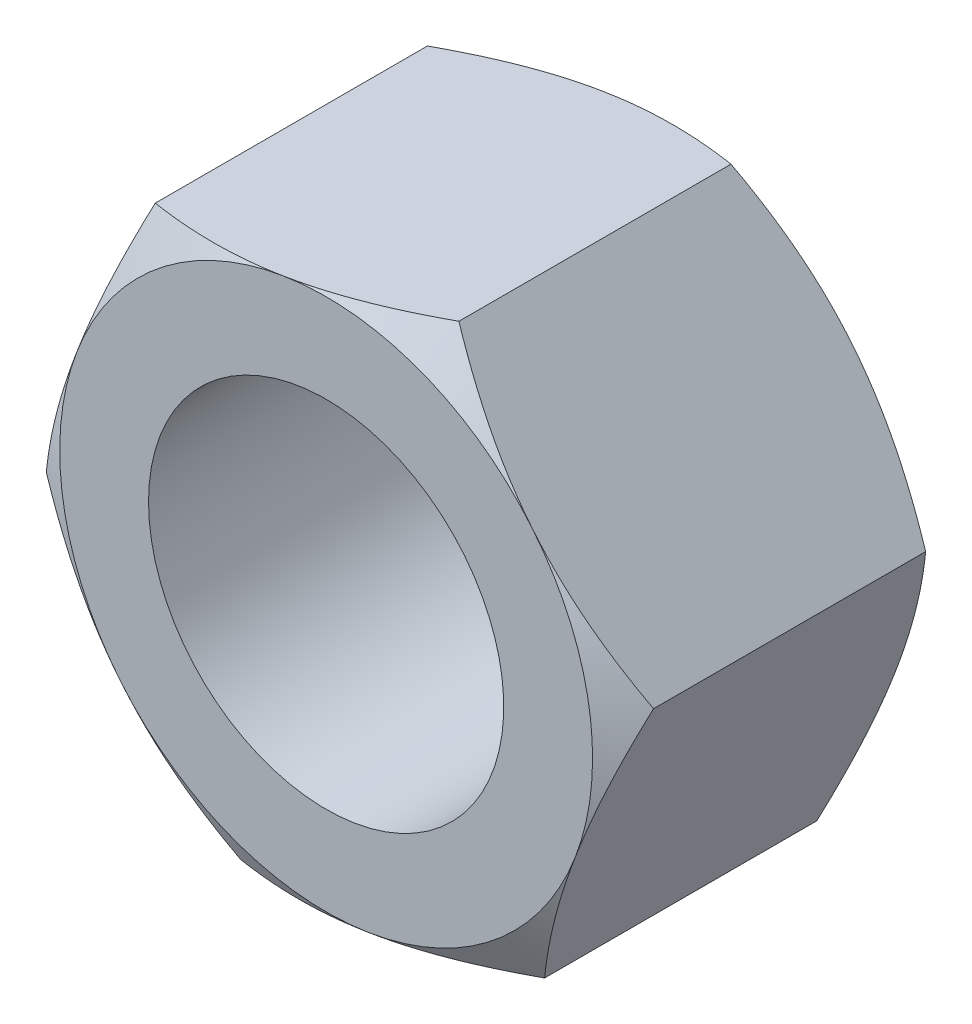
from build123d import *

# Parameters (mm, degrees)
BOSS_EXTRUDE1_DEPTH = 18
SKETCH2_OUTSIDE_W   = 108.628
SKETCH2_OUTSIDE_H   = 106.834
SKETCH2_OUTSIDE_R   = 15
CUT_EXTRUDE1_DEPTH  = 18
CUT_EXTRUDE1_DRAFT  = -60
SKETCH3_OUTSIDE_W   = 108.628
SKETCH3_OUTSIDE_H   = 106.834
SKETCH3_OUTSIDE_R   = 15
CUT_EXTRUDE2_DEPTH  = 18
CUT_EXTRUDE2_DRAFT  = -60
SKETCH4_R           = 10
CUT_EXTRUDE3_DEPTH  = 30.641307412


with BuildPart() as part:
    # Sketch1 → Boss-Extrude1 (new body)
    with BuildSketch(Plane.XY):
        Polygon((6.134122691, 16.197917731), (-10.960746898, 13.411264946), (-17.094869589, -2.786652785), (-6.134122691, -16.197917731), (10.960746898, -13.411264946), (17.094869589, 2.786652785), align=None)
    extrude(amount=BOSS_EXTRUDE1_DEPTH)


with BuildPart() as cut_extrude1_tool:
    # Sketch2 outside → Cut-Extrude1 (with draft: the straight prism first)
    with BuildSketch(Plane.XY.offset(18)):
        Rectangle(SKETCH2_OUTSIDE_W, SKETCH2_OUTSIDE_H)
        Circle(SKETCH2_OUTSIDE_R, mode=Mode.SUBTRACT)
    extrude(amount=-CUT_EXTRUDE1_DEPTH)
    # Cut-Extrude1: the draft: its side faces are tilted about the plane it starts from
    cut_extrude1_sides = [cut_extrude1_tool.faces().sort_by_distance(p)[0] for p in [
        (0, -53.417, 9),
        (54.314, 0, 9),
        (0, 53.417, 9),
        (-54.314, 0, 9),
        (-15, 0, 9),
    ]]
    draft(cut_extrude1_sides, Plane.XY.offset(18), CUT_EXTRUDE1_DRAFT)


with BuildPart() as part_1:
    add(part.part)

    # Cut-Extrude1: cut by cut_extrude1_tool
    add(cut_extrude1_tool.part, mode=Mode.SUBTRACT)


with BuildPart() as cut_extrude2_tool:
    # Sketch3 outside → Cut-Extrude2 (with draft: the straight prism first)
    with BuildSketch(Plane(origin=(0, 0, 0), x_dir=(-1, 0, 0), z_dir=(0, 0, -1))):
        Rectangle(SKETCH3_OUTSIDE_W, SKETCH3_OUTSIDE_H)
        Circle(SKETCH3_OUTSIDE_R, mode=Mode.SUBTRACT)
    extrude(amount=-CUT_EXTRUDE2_DEPTH)
    # Cut-Extrude2: the draft: its side faces are tilted about the plane it starts from
    cut_extrude2_sides = [cut_extrude2_tool.faces().sort_by_distance(p)[0] for p in [
        (0, -53.417, 9),
        (-54.314, 0, 9),
        (0, 53.417, 9),
        (54.314, 0, 9),
        (15, 0, 9),
    ]]
    draft(cut_extrude2_sides, Plane(origin=(0, 0, 0), x_dir=(-1, 0, 0), z_dir=(0, 0, -1)), CUT_EXTRUDE2_DRAFT)


with BuildPart() as part_2:
    add(part_1.part)

    # Cut-Extrude2: cut by cut_extrude2_tool
    add(cut_extrude2_tool.part, mode=Mode.SUBTRACT)

    # Sketch4 → Cut-Extrude3 (cut, through all)
    with BuildSketch(Plane(origin=(0, 0, 0), x_dir=(-1, 0, 0), z_dir=(0, 0, -1))):
        Circle(SKETCH4_R)
    extrude(amount=-CUT_EXTRUDE3_DEPTH, mode=Mode.SUBTRACT)


solid = part_2.part
